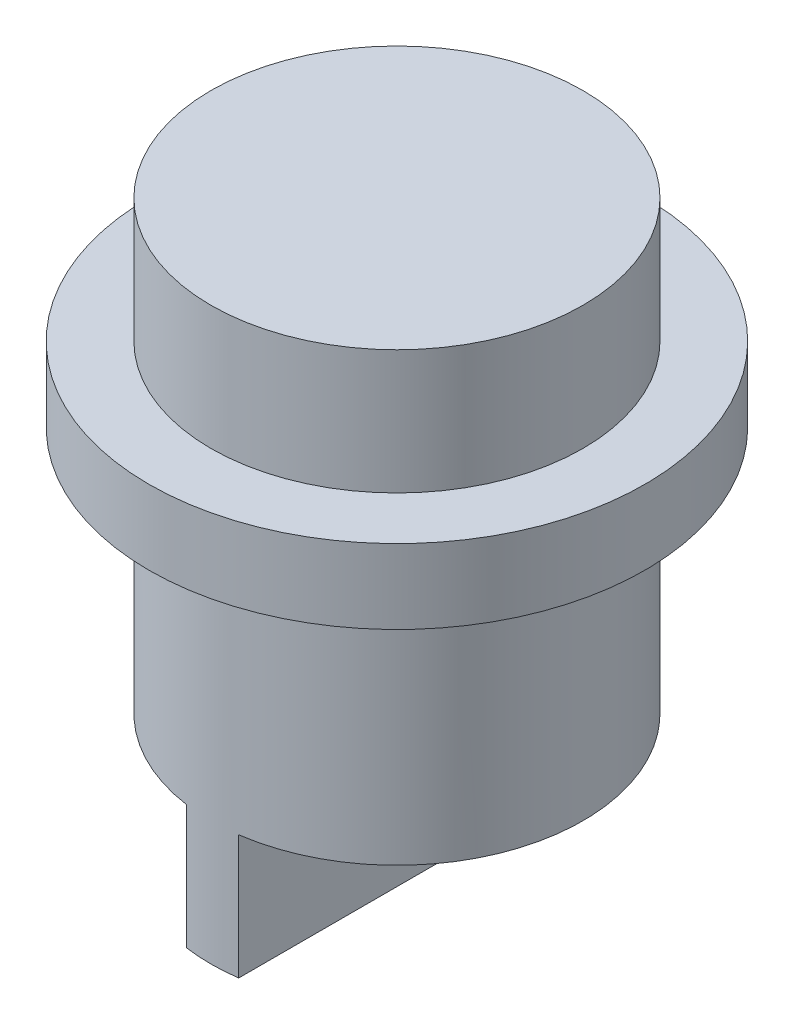
from build123d import *
from build123d.topology import SkipClean

# Parameters (mm, degrees)
SKETCH_1_R      = 7.5
EXTRUDE_1_DEPTH = 10
SKETCH_2_R      = 10
EXTRUDE_2_DEPTH = 3
SKETCH_3_R      = 7.5
EXTRUDE_3_DEPTH = 5
EXTRUDE_START   = 5
EXTRUDE_4_DEPTH = 5


with BuildPart() as part:
    # 草图1 → 凸台-拉伸1 (new body)
    with BuildSketch(Plane(origin=(0, 0, 0), x_dir=(1, 0, 0), z_dir=(0, 1, 0))):
        with Locations(Location((0, 0, 0), (0, 0, 270))):
            Circle(SKETCH_1_R)
    extrude(amount=EXTRUDE_1_DEPTH)

    # 草图2 → 凸台-拉伸2 (add)
    with BuildSketch(Plane(origin=(0, 10, 0), x_dir=(1, 0, 0), z_dir=(0, 1, 0))):
        with Locations(Location((0, 0, 0), (0, 0, 270))):
            Circle(SKETCH_2_R)
    extrude(amount=EXTRUDE_2_DEPTH)

    # 草图3 → 凸台-拉伸3 (add)
    with BuildSketch(Plane(origin=(0, 13, 0), x_dir=(1, 0, 0), z_dir=(0, 1, 0))):
        with Locations(Location((0, 0, 0), (0, 0, 270))):
            Circle(SKETCH_3_R)
    extrude(amount=EXTRUDE_3_DEPTH)

    # 草图4 → 凸台-拉伸4 (add)
    with SkipClean():  # the faces are left unmerged after this step: merging them gives an invalid solid
        with BuildSketch(Plane.XZ.offset(EXTRUDE_START)):
            with BuildLine():
                Line((-1.048132204, 7.426400129), (-1.048132204, -7.426400129))
                ThreePointArc((-1.048132204, -7.426400129), (0, -7.5), (1.048132204, -7.426400129))
                Line((1.048132204, -7.426400129), (1.048132204, 7.426400129))
                ThreePointArc((1.048132204, 7.426400129), (0, 7.5), (-1.048132204, 7.426400129))
            make_face()
        extrude(amount=-EXTRUDE_4_DEPTH)


solid = part.part
